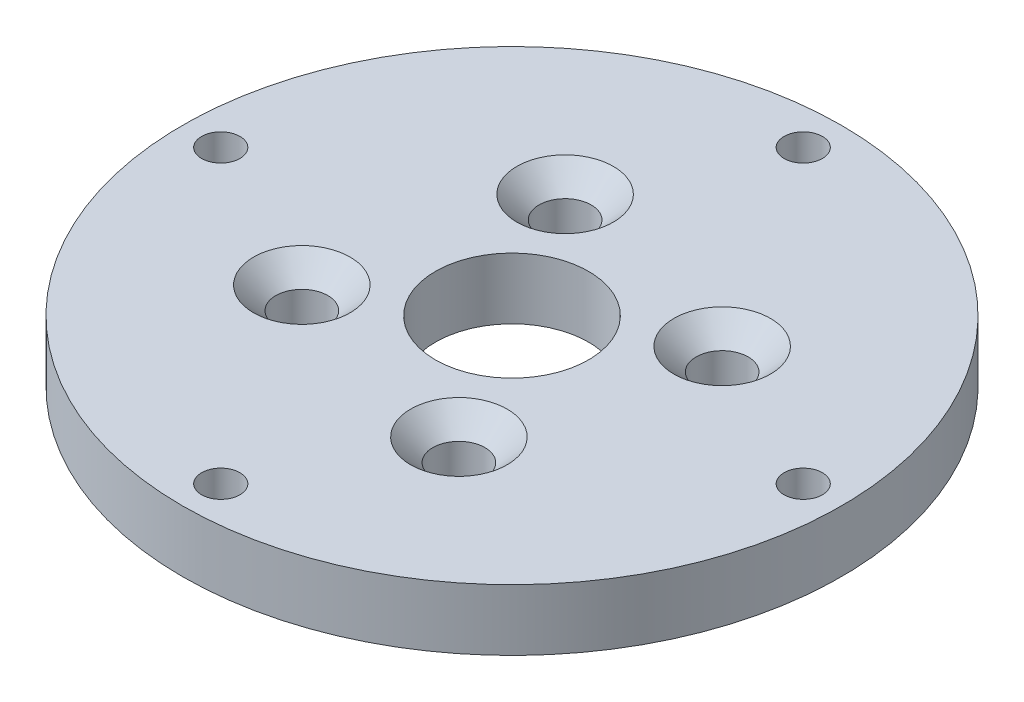
from build123d import *

# Parameters (mm, degrees)
ESQUISSE1_R                                    = 21.5
ESQUISSE1_R_2                                  = 5
ESQUISSE1_R_3                                  = 1
ESQUISSE1_R_4                                  = 1.25
BOSS_EXTRU_1_DEPTH                             = 4
FRAISAGE_POUR_VIS_T_TE_FRAIS_E_M31_D           = 3.4
FRAISAGE_POUR_VIS_T_TE_FRAIS_E_M31_CSINK_D     = 6.3
FRAISAGE_POUR_VIS_T_TE_FRAIS_E_M31_CSINK_ANGLE = 90


with BuildPart() as part:
    # Esquisse1 → Boss.-Extru.1 (new body)
    with BuildSketch(Plane(origin=(0, 0, 0), x_dir=(1, 0, 0), z_dir=(0, 1, 0))):
        with Locations(Location((0, 0, 0), (0, 0, 270))):
            Circle(ESQUISSE1_R)
        with Locations(Location((0, 0, 0), (0, 0, 270))):
            Circle(ESQUISSE1_R_2, mode=Mode.SUBTRACT)
        with Locations(Location((-5.123344298, 8.587860223, 0), (0, 0, 270))):
            Circle(ESQUISSE1_R_3, mode=Mode.SUBTRACT)
        with Locations(Location((8.587860223, 5.123344298, 0), (0, 0, 270))):
            Circle(ESQUISSE1_R_3, mode=Mode.SUBTRACT)
        with Locations(Location((5.123344298, -8.587860223, 0), (0, 0, 270))):
            Circle(ESQUISSE1_R_3, mode=Mode.SUBTRACT)
        with Locations(Location((-8.587860223, -5.123344298, 0), (0, 0, 270))):
            Circle(ESQUISSE1_R_3, mode=Mode.SUBTRACT)
        with Locations(Location((0, 19, 0), (0, 0, 270))):
            Circle(ESQUISSE1_R_4, mode=Mode.SUBTRACT)
        with Locations(Location((19, 0, 0), (0, 0, 270))):
            Circle(ESQUISSE1_R_4, mode=Mode.SUBTRACT)
        with Locations(Location((0, -19, 0), (0, 0, 270))):
            Circle(ESQUISSE1_R_4, mode=Mode.SUBTRACT)
        with Locations(Location((-19, 0, 0), (0, 0, 270))):
            Circle(ESQUISSE1_R_4, mode=Mode.SUBTRACT)
    extrude(amount=BOSS_EXTRU_1_DEPTH)

    # Fraisage pour vis à tête fraisée M31 (through all)
    with Locations(Plane(origin=(0, 4, 0), x_dir=(1, 0, 0), z_dir=(0, 1, 0))):
        with Locations((-5.123344298, 8.587860223), (8.587860223, 5.123344298), (5.123344298, -8.587860223), (-8.587860223, -5.123344298)):
            CounterSinkHole(FRAISAGE_POUR_VIS_T_TE_FRAIS_E_M31_D / 2, FRAISAGE_POUR_VIS_T_TE_FRAIS_E_M31_CSINK_D / 2, counter_sink_angle=FRAISAGE_POUR_VIS_T_TE_FRAIS_E_M31_CSINK_ANGLE)


solid = part.part
